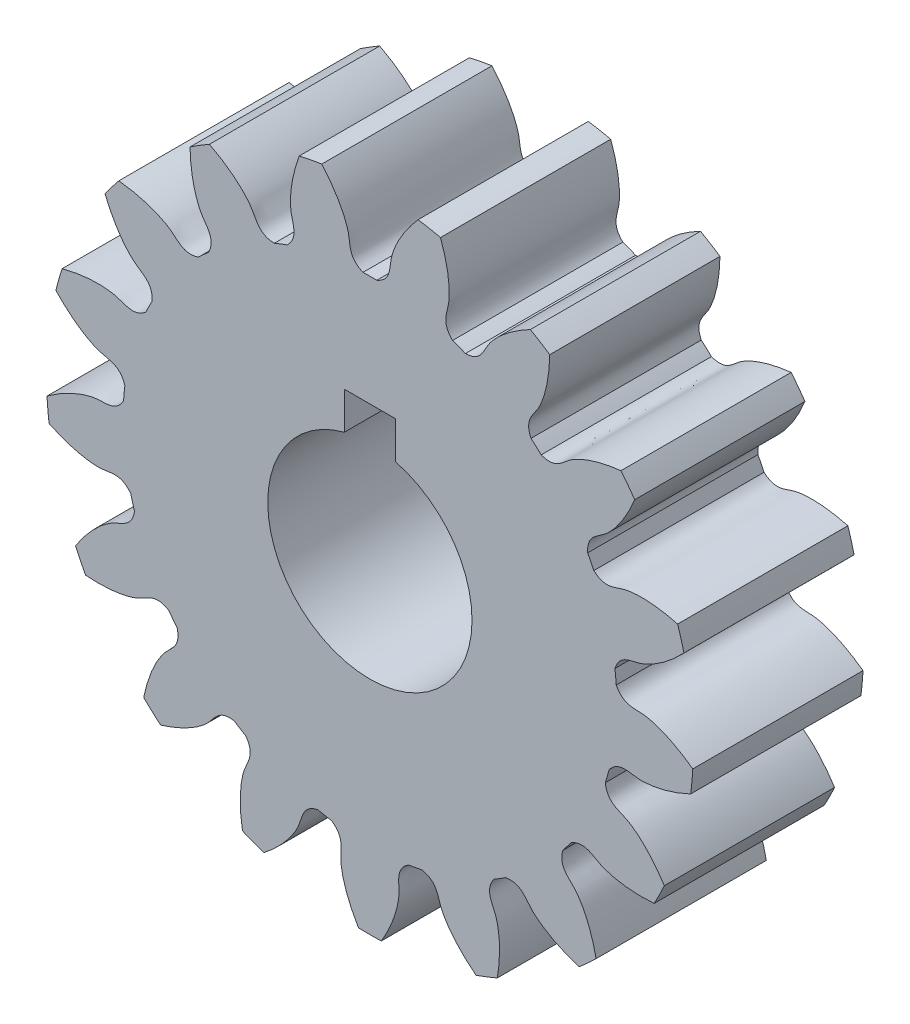
from build123d import *

# Parameters (mm, degrees)
SKETCH_1_R               = 19
EXTRUDE_1_DEPTH          = 10
CUT_EXTRUDE_1_DEPTH      = 29.670542374
PATTERN_CIRCULAR_1_COUNT = 17
CUT_EXTRUDE_2_REACH      = 30.65


with BuildPart() as part:
    # 草图1 → 凸台-拉伸1 (new body)
    with BuildSketch(Plane.XY):
        Circle(SKETCH_1_R)
    extrude(amount=EXTRUDE_1_DEPTH)

    # 草图2 → 切除-拉伸1 (cut, through all)
    with BuildSketch(Plane.XY):
        with BuildLine():
            ThreePointArc((0.403387494, 14.494387829), (0, 14.5), (-0.403387494, 14.494387829))
            add(Edge.make_bspline(
                [(-0.403387494, 14.494387829), (-1.255759481, 14.849644042), (-1.132390756, 15.509626813), (-1.276611209, 16.129648275), (-1.289951469, 16.18230119), (-1.306037005, 16.240838627), (-1.32510118, 16.305170665), (-1.347383555, 16.375198727), (-1.373118159, 16.450817515), (-1.40253689, 16.531914502), (-1.435868224, 16.618370188), (-1.473337358, 16.710058129), (-1.515165928, 16.80684504), (-1.561571855, 16.908590882), (-1.612769151, 17.015148962), (-1.66896775, 17.12636603), (-1.730373323, 17.242082389), (-1.797187111, 17.362132), (-1.869605751, 17.4863426), (-1.947821109, 17.61453582), (-2.032020115, 17.746527309), (-2.1223846, 17.882126855), (-2.219091138, 18.021138524), (-2.32231089, 18.163360791), (-2.432209452, 18.308586678), (-2.548946705, 18.456603899), (-2.67267667, 18.607195006), (-2.803547366, 18.760137539), (-2.941700674, 18.915204179), (-3.087272199, 19.072162909), (-3.24039114, 19.23077717), (-3.401180166, 19.390806026), (-3.569755292, 19.552004336), (-3.746225758, 19.71412292), (-3.930693918, 19.876908731), (-4.123255131, 20.040105038), (-4.323997649, 20.203451599), (-4.533002522, 20.366684847), (-4.750343497, 20.529538073), (-4.976086928, 20.691741613), (-5.210291694, 20.853023038), (-5.453009069, 21.013107349), (-5.79164327, 21.226861067), (-6.053153804, 21.381051942), (-6.231291666, 21.481438237)],
                knots=[0, 0, 0, 0, 0.193882922, 0.199023975, 0.204850501, 0.211362501, 0.218559975, 0.226442923, 0.235011345, 0.24426524, 0.254204608, 0.264829451, 0.276139767, 0.288135557, 0.300816821, 0.314183558, 0.328235769, 0.342973453, 0.358396612, 0.374505244, 0.39129935, 0.408778929, 0.426943982, 0.445794509, 0.46533051, 0.485551984, 0.506458932, 0.528051354, 0.550329249, 0.573292619, 0.596941461, 0.621275778, 0.646295568, 0.672000832, 0.69839157, 0.725467781, 0.753229466, 0.781676625, 0.810809257, 0.840627364, 0.871130943, 0.902319997, 0.934194524, 1, 1, 1, 1], degree=3))
            ThreePointArc((-6.231291666, 21.481438237), (0, 22.366966369), (6.231291666, 21.481438237))
            add(Edge.make_bspline(
                [(0.403387494, 14.494387829), (1.255759481, 14.849644042), (1.132390756, 15.509626813), (1.276611209, 16.129648275), (1.289951469, 16.18230119), (1.306037005, 16.240838627), (1.32510118, 16.305170665), (1.347383555, 16.375198727), (1.373118159, 16.450817515), (1.40253689, 16.531914502), (1.435868224, 16.618370188), (1.473337358, 16.710058129), (1.515165928, 16.80684504), (1.561571855, 16.908590882), (1.612769151, 17.015148962), (1.66896775, 17.12636603), (1.730373323, 17.242082389), (1.797187111, 17.362132), (1.869605751, 17.4863426), (1.947821109, 17.61453582), (2.032020115, 17.746527309), (2.1223846, 17.882126855), (2.219091138, 18.021138524), (2.32231089, 18.163360791), (2.432209452, 18.308586678), (2.548946705, 18.456603899), (2.67267667, 18.607195006), (2.803547366, 18.760137539), (2.941700674, 18.915204179), (3.087272199, 19.072162909), (3.24039114, 19.23077717), (3.401180166, 19.390806026), (3.569755292, 19.552004336), (3.746225758, 19.71412292), (3.930693918, 19.876908731), (4.123255131, 20.040105038), (4.323997649, 20.203451599), (4.533002522, 20.366684847), (4.750343497, 20.529538073), (4.976086928, 20.691741613), (5.210291694, 20.853023038), (5.453009069, 21.013107349), (5.79164327, 21.226861067), (6.053153804, 21.381051942), (6.231291666, 21.481438237)],
                knots=[0, 0, 0, 0, 0.193882922, 0.199023975, 0.204850501, 0.211362501, 0.218559975, 0.226442923, 0.235011345, 0.24426524, 0.254204608, 0.264829451, 0.276139767, 0.288135557, 0.300816821, 0.314183558, 0.328235769, 0.342973453, 0.358396612, 0.374505244, 0.39129935, 0.408778929, 0.426943982, 0.445794509, 0.46533051, 0.485551984, 0.506458932, 0.528051354, 0.550329249, 0.573292619, 0.596941461, 0.621275778, 0.646295568, 0.672000832, 0.69839157, 0.725467781, 0.753229466, 0.781676625, 0.810809257, 0.840627364, 0.871130943, 0.902319997, 0.934194524, 1, 1, 1, 1], degree=3))
        make_face()
    cut_extrude_1 = extrude(amount=CUT_EXTRUDE_1_DEPTH, mode=Mode.SUBTRACT)

    # 阵列(圆周)1: 切除-拉伸1 ×17 about axis
    pattern_circular_1_axis = Axis((0, 0, -0.5), (0, 0, 1))
    for i in range(1, PATTERN_CIRCULAR_1_COUNT):
        add(cut_extrude_1.rotate(pattern_circular_1_axis, i * 360 / PATTERN_CIRCULAR_1_COUNT), mode=Mode.SUBTRACT)

    # 草图4 → 切除-拉伸2 (cut, up to next)
    with BuildSketch(Plane.XY.offset(10), mode=Mode.PRIVATE) as cut_extrude_2_sk1:
        with BuildLine():
            Line((-1.5, 5.809475019), (-1.5, 8))
            Line((-1.5, 8), (1.5, 8))
            Line((1.5, 8), (1.5, 5.809475019))
            ThreePointArc((1.5, 5.809475019), (0, -6), (-1.5, 5.809475019))
        make_face()
    cut_extrude_2_tool1 = extrude(cut_extrude_2_sk1.sketch, amount=-CUT_EXTRUDE_2_REACH, mode=Mode.PRIVATE) & part.part
    add(cut_extrude_2_tool1.solids().sort_by_distance((0, 0.361524, 10))[0], mode=Mode.SUBTRACT)


solid = part.part
